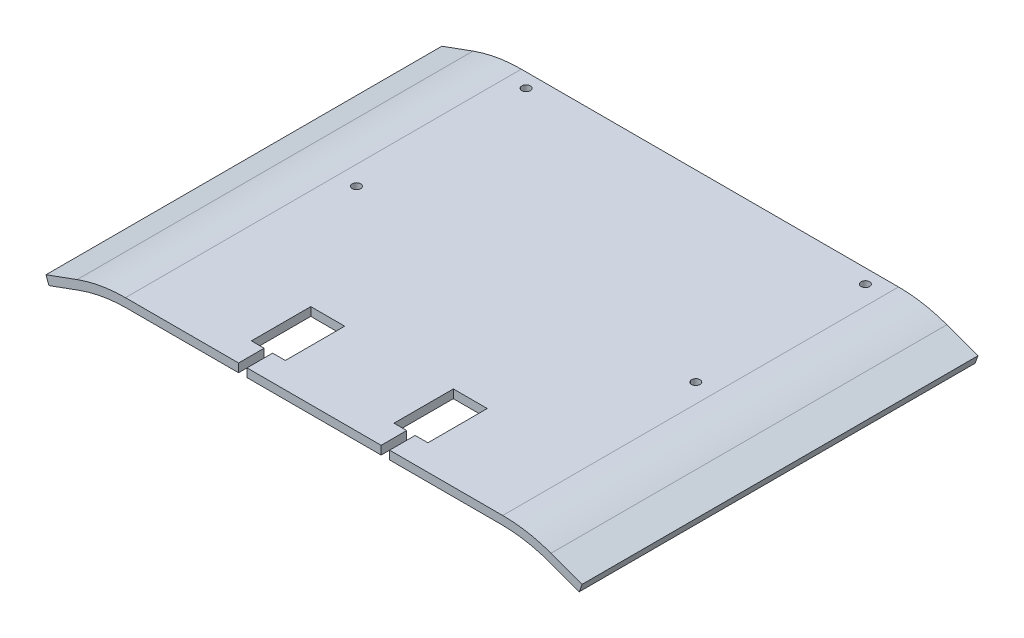
from build123d import *

# Parameters (mm, degrees)
BOSS_EXTRUDE1_DEPTH = 140
FILLET1_R           = 50
FILLET2_R           = 50
CUT_EXTRUDE1_DEPTH  = 150
SKETCH4_R           = 1.5
CUT_EXTRUDE2_DEPTH  = 10
SKETCH5_R           = 3
SKETCH5_R_2         = 1.5
BOSS_EXTRUDE2_DEPTH = 12


with BuildPart() as part:
    # Sketch1 → Boss-Extrude1 (new body)
    with BuildSketch(Plane.XY):
        Polygon((0, 0), (150, 0), (168.793852416, -6.840402867), (169.819912846, -4.021325004), (150.528980942, 3), (-0.528980942, 3), (-19.819912846, -4.021325004), (-18.793852416, -6.840402867), align=None)
    extrude(amount=BOSS_EXTRUDE1_DEPTH)

    # Fillet1
    fillet1_edges = [part.edges().sort_by_distance(p)[0] for p in [
        (-0.528980942, 3, 70),
        (150.528980942, 3, 70),
    ]]
    fillet(fillet1_edges, radius=FILLET1_R)

    # Fillet2
    fillet2_edges = [part.edges().sort_by_distance(p)[0] for p in [
        (150, 0, 70),
        (0, 0, 70),
    ]]
    fillet(fillet2_edges, radius=FILLET2_R)

    # Sketch3 → Cut-Extrude1 (cut)
    with BuildSketch(Plane(origin=(0, 3, 0), x_dir=(1, 0, 0), z_dir=(0, 1, 0))):
        Polygon((101.712631907, -140), (101.712631907, -130.960680496), (106.212631907, -130.960680496), (106.212631907, -109.960680496), (94.212631907, -109.960680496), (94.212631907, -130.960680496), (98.712631907, -130.960680496), (98.712631907, -140), align=None)
        Polygon((51.287368093, -140), (51.287368093, -130.960680496), (55.787368093, -130.960680496), (55.787368093, -109.960680496), (43.787368093, -109.960680496), (43.787368093, -130.960680496), (48.287368093, -130.960680496), (48.287368093, -140), align=None)
    extrude(amount=-CUT_EXTRUDE1_DEPTH, mode=Mode.SUBTRACT)

    # Sketch4 → Cut-Extrude2 (cut)
    with BuildSketch(Plane(origin=(0, 3, 0), x_dir=(1, 0, 0), z_dir=(0, 1, 0))):
        with Locations(Location((134.997368093, -5, 0), (0, 0, 180))):
            Circle(SKETCH4_R)
        with Locations(Location((14.997368093, -5, 0), (0, 0, 180))):
            Circle(SKETCH4_R)
        with Locations(Location((135.002631907, -64.999999769, 0), (0, 0, 180))):
            Circle(SKETCH4_R)
        with Locations(Location((14.997368093, -64.999999769, 0), (0, 0, 180))):
            Circle(SKETCH4_R)
    extrude(amount=-CUT_EXTRUDE2_DEPTH, mode=Mode.SUBTRACT)

    # Sketch5 → Boss-Extrude2 (add)
    # profile 1 of 4: a face of its own
    with BuildSketch(Plane(origin=(0, 3, 0), x_dir=(1, 0, 0), z_dir=(0, 1, 0))):
        with Locations(Location((14.997368093, -5, 0), (0, 0, 180))):
            Circle(SKETCH5_R)
        with Locations(Location((14.997368093, -5, 0), (0, 0, 180))):
            Circle(SKETCH5_R_2, mode=Mode.SUBTRACT)
    # profile 2 of 4: a face of its own
    with BuildSketch(Plane(origin=(0, 3, 0), x_dir=(1, 0, 0), z_dir=(0, 1, 0))):
        with Locations(Location((134.997368093, -5, 0), (0, 0, 180))):
            Circle(SKETCH5_R)
        with Locations(Location((134.997368093, -5, 0), (0, 0, 180))):
            Circle(SKETCH5_R_2, mode=Mode.SUBTRACT)
    # profile 3 of 4: a face of its own
    with BuildSketch(Plane(origin=(0, 3, 0), x_dir=(1, 0, 0), z_dir=(0, 1, 0))):
        with Locations(Location((135.002631907, -64.999999769, 0), (0, 0, 180))):
            Circle(SKETCH5_R)
        with Locations(Location((135.002631907, -64.999999769, 0), (0, 0, 180))):
            Circle(SKETCH5_R_2, mode=Mode.SUBTRACT)
    # profile 4 of 4: a face of its own
    with BuildSketch(Plane(origin=(0, 3, 0), x_dir=(1, 0, 0), z_dir=(0, 1, 0))):
        with Locations(Location((14.997368093, -64.999999769, 0), (0, 0, 180))):
            Circle(SKETCH5_R)
        with Locations(Location((14.997368093, -64.999999769, 0), (0, 0, 180))):
            Circle(SKETCH5_R_2, mode=Mode.SUBTRACT)
    extrude(amount=-BOSS_EXTRUDE2_DEPTH)


solid = part.part
